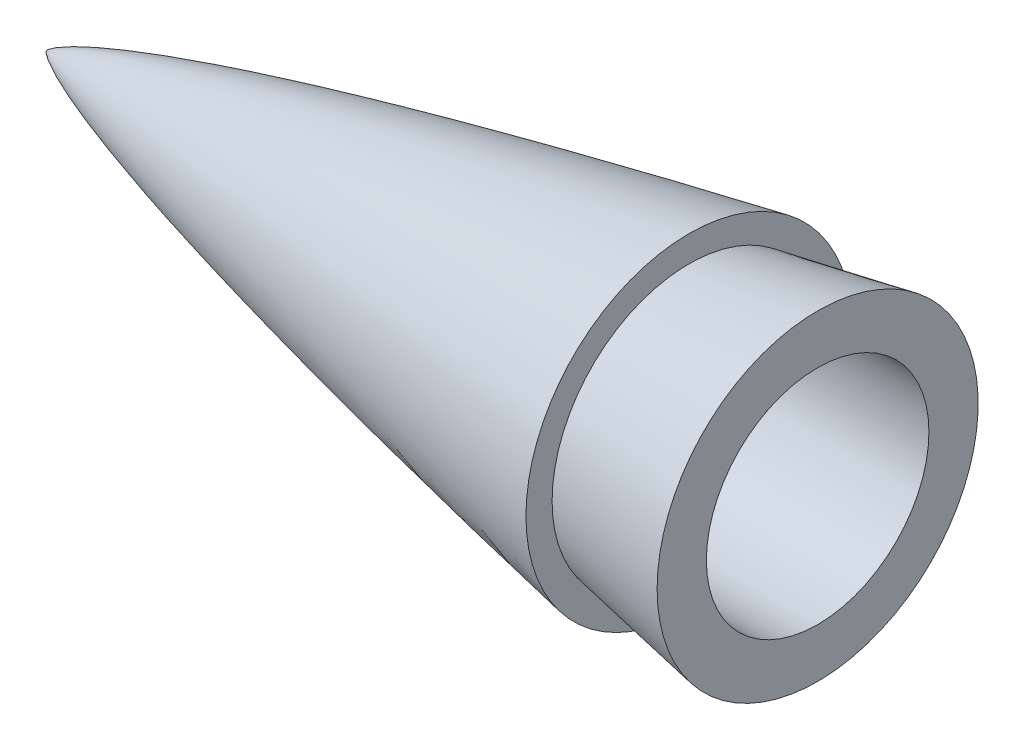
from build123d import *


with BuildPart() as part:
    # Sketch3 → Revolve2 (revolve)
    with BuildSketch(Plane.XY, mode=Mode.PRIVATE) as revolve2_sk:
        with BuildLine():
            Line((60, 8.655408996), (60, 12.487500002))
            Line((60, 12.487500002), (50, 10.655408996))
            Line((50, 10.655408996), (50, 12.690393655))
            add(Edge.make_bspline(
                [(0, 0), (0.002661369, 0.00735768), (0.009108664, 0.021455176), (0.026858739, 0.047022825), (0.06841925, 0.093346235), (0.131428409, 0.1510252), (0.216810716, 0.21833703), (0.338162364, 0.304110587), (0.48394243, 0.397396692), (0.655054985, 0.498068807), (0.851568565, 0.605626998), (1.137654509, 0.753350528), (1.581543682, 0.966113556), (2.335050733, 1.296122672), (3.682901567, 1.826629283), (6.111473252, 2.674476309), (10.574628301, 4.037968264), (18.951733743, 6.252001296), (29.81904523, 8.715114583), (39.484763039, 10.685203545), (46.893919131, 12.107488124), (50, 12.690393655)],
                knots=[0, 0, 0, 0, 0, 4.1103e-05, 8.2207e-05, 0.000164413, 0.000328826, 0.000493239, 0.000657652, 0.000951494, 0.001245335, 0.001544792, 0.001844249, 0.002657057, 0.00385252, 0.005901677, 0.009515863, 0.016280764, 0.028569004, 0.051793804, 0.068535602, 0.068535602, 0.068535602, 0.068535602, 0.068535602], degree=4))
            Line((0, 0), (4.552555597, 0))
            Line((4.552555597, 0), (39.689361591, 8.655408996))
            Line((39.689361591, 8.655408996), (60, 8.655408996))
        make_face()
    revolve(revolve2_sk.sketch.rotate(Axis((0, 0, 0), (1, 0, 0)), 90), axis=Axis((0, 0, 0), (1, 0, 0)))


solid = part.part
